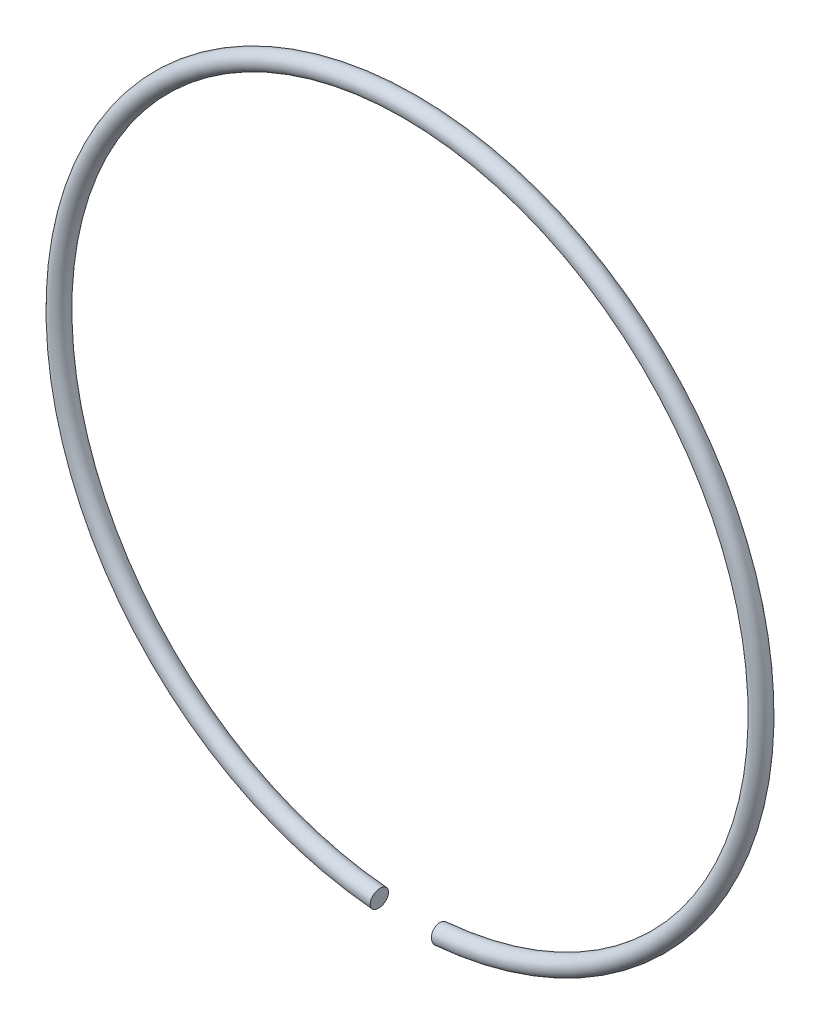
from build123d import *
from build123d.topology import SkipClean

# Parameters (mm, degrees)
SKETCH1_R      = 1.5
REVOLVE1_ANGLE = 350


with BuildPart() as part:
    # Sketch1 → Revolve1 (revolve, symmetric)
    with SkipClean():  # the faces are left unmerged after this step: merging them gives an invalid solid
        with BuildSketch(Plane(origin=(0, 0, 0), x_dir=(0, 0, -1), z_dir=(1, 0, 0))) as revolve1_sk:
            with Locations((0, 57.5)):
                Circle(SKETCH1_R)
        revolve(axis=Axis((0, 0, 0), (0, 0, -1)), revolution_arc=REVOLVE1_ANGLE / 2)
        revolve(revolve1_sk.sketch, axis=Axis((0, 0, 0), (0, 0, 1)), revolution_arc=REVOLVE1_ANGLE / 2)


solid = part.part
